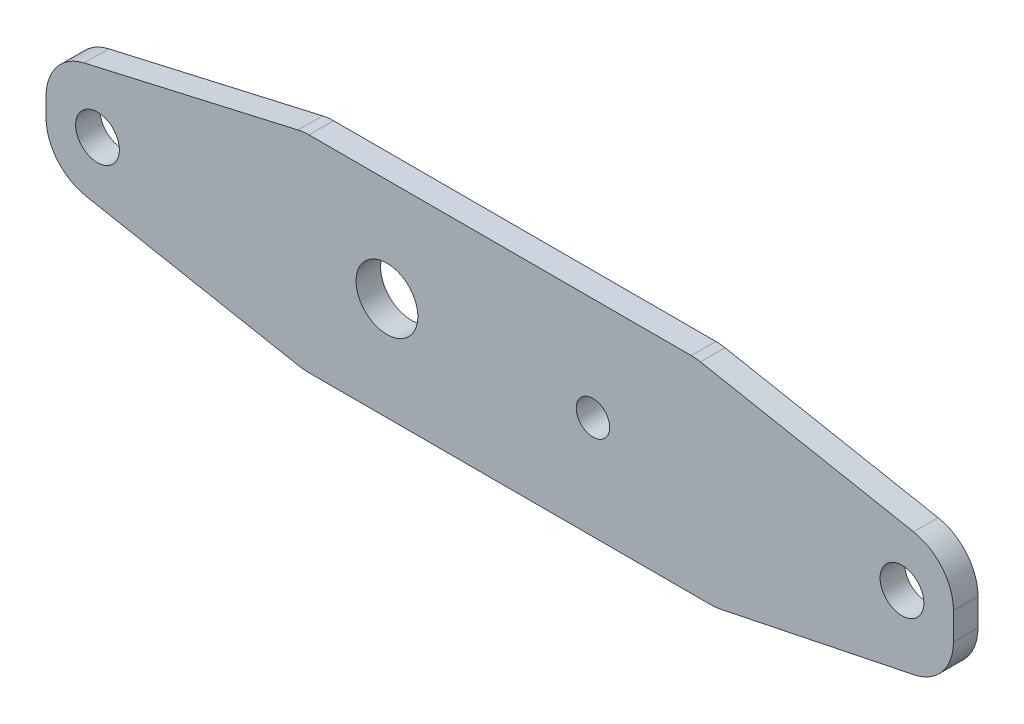
from build123d import *

# Parameters (mm, degrees)
SKETCH1_R           = 6
SKETCH1_R_2         = 3.25
SKETCH1_R_3         = 4.25
BOSS_EXTRUDE2_DEPTH = 4.7625
FILLET1_R           = 9.53


with BuildPart() as part:
    # Sketch1 → Boss-Extrude2 (new body)
    with BuildSketch(Plane.XY):
        Polygon((-45.444705817, 407.184725354), (-95.444705817, 395.759725354), (-95.444705817, 376.709725354), (-45.444705817, 367.184725354), (34.555294183, 367.184725354), (80.755294183, 376.714725354), (80.755294183, 397.654725354), (30.755294183, 407.184725354), align=None)
        with Locations(Location((-29.244705817, 387.184725354, 0), (0, 0, 180))):
            Circle(SKETCH1_R, mode=Mode.SUBTRACT)
        with Locations(Location((10.755294183, 387.184725354, 0), (0, 0, 180))):
            Circle(SKETCH1_R_2, mode=Mode.SUBTRACT)
        with Locations(Location((-85.444705817, 386.234725354, 0), (0, 0, 180))):
            Circle(SKETCH1_R_3, mode=Mode.SUBTRACT)
        with Locations(Location((70.755294183, 388.134725354, 0), (0, 0, 180))):
            Circle(SKETCH1_R_3, mode=Mode.SUBTRACT)
    extrude(amount=BOSS_EXTRUDE2_DEPTH)

    # Fillet1
    fillet1_edges = [part.edges().sort_by_distance(p)[0] for p in [
        (-95.444705817, 376.709725354, 2.38125),
        (-95.444705817, 395.759725354, 2.38125),
        (-45.444705817, 407.184725354, 2.38125),
        (30.755294183, 407.184725354, 2.38125),
        (80.755294183, 397.654725354, 2.38125),
        (80.755294183, 376.714725354, 2.38125),
        (34.555294183, 367.184725354, 2.38125),
        (-45.444705817, 367.184725354, 2.38125),
    ]]
    fillet(fillet1_edges, radius=FILLET1_R)


solid = part.part
